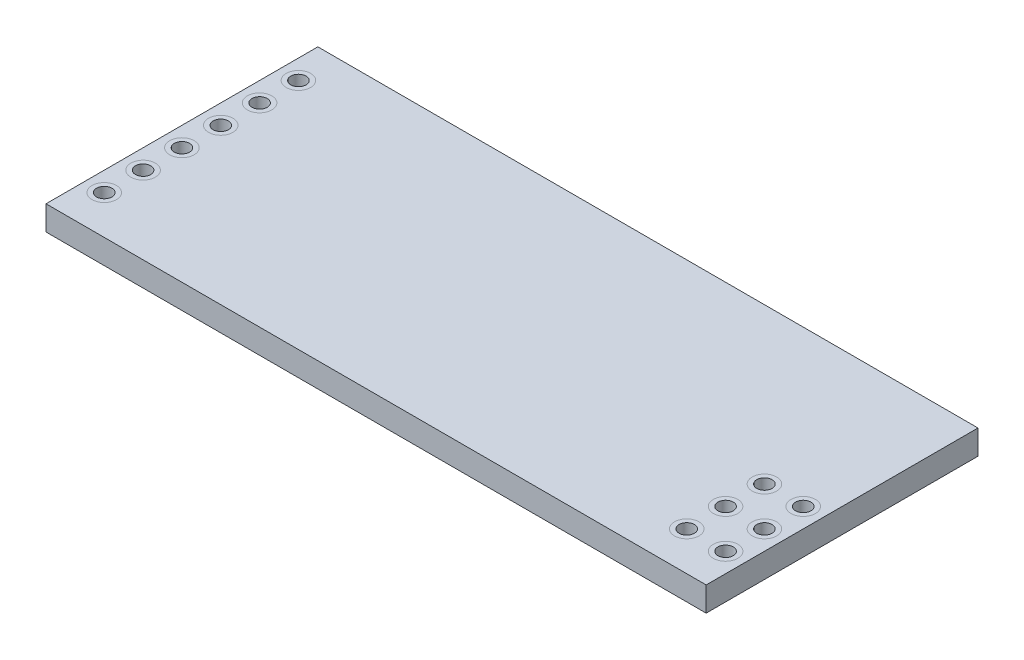
from build123d import *

# Parameters (mm, degrees)
SKETCH1_W           = 43.18
SKETCH1_H           = 17.78
SKETCH1_R           = 0.5
BOSS_EXTRUDE1_DEPTH = 1.6
CHAMFER1_SIZE       = 0.3
CHAMFER1_SIZE2      = 0.000523599
CHAMFER2_SIZE       = 0.3
CHAMFER2_SIZE2      = 0.000523599


with BuildPart() as part:
    # Sketch1 → Boss-Extrude1 (new body)
    with BuildSketch(Plane(origin=(0, 0, 0), x_dir=(1, 0, 0), z_dir=(0, 1, 0))):
        Rectangle(SKETCH1_W, SKETCH1_H)
        with Locations(Location((20.32, -6.35, 0), (0, 0, 270))):
            Circle(SKETCH1_R, mode=Mode.SUBTRACT)
        with Locations(Location((-20.32, 3.81, 0), (0, 0, 270))):
            Circle(SKETCH1_R, mode=Mode.SUBTRACT)
        with Locations(Location((-20.32, 1.27, 0), (0, 0, 270))):
            Circle(SKETCH1_R, mode=Mode.SUBTRACT)
        with Locations(Location((-20.32, -1.27, 0), (0, 0, 270))):
            Circle(SKETCH1_R, mode=Mode.SUBTRACT)
        with Locations(Location((-20.32, 6.35, 0), (0, 0, 270))):
            Circle(SKETCH1_R, mode=Mode.SUBTRACT)
        with Locations(Location((-20.32, -3.81, 0), (0, 0, 270))):
            Circle(SKETCH1_R, mode=Mode.SUBTRACT)
        with Locations(Location((-20.32, -6.35, 0), (0, 0, 270))):
            Circle(SKETCH1_R, mode=Mode.SUBTRACT)
        with Locations(Location((17.78, -6.35, 0), (0, 0, 270))):
            Circle(SKETCH1_R, mode=Mode.SUBTRACT)
        with Locations(Location((17.78, -3.81, 0), (0, 0, 270))):
            Circle(SKETCH1_R, mode=Mode.SUBTRACT)
        with Locations(Location((17.78, -1.27, 0), (0, 0, 270))):
            Circle(SKETCH1_R, mode=Mode.SUBTRACT)
        with Locations(Location((20.32, -3.81, 0), (0, 0, 270))):
            Circle(SKETCH1_R, mode=Mode.SUBTRACT)
        with Locations(Location((20.32, -1.27, 0), (0, 0, 270))):
            Circle(SKETCH1_R, mode=Mode.SUBTRACT)
    extrude(amount=BOSS_EXTRUDE1_DEPTH)

    # Chamfer1
    chamfer1_edges = [part.edges().sort_by_distance(p)[0] for p in [
        (20.32, 1.6, 5.85),
        (-20.32, 1.6, -4.31),
        (-20.32, 1.6, -1.77),
        (-20.32, 1.6, 0.77),
        (-20.32, 1.6, 3.31),
        (-20.32, 1.6, 5.85),
        (-20.32, 1.6, -6.85),
        (17.78, 1.6, 5.85),
        (17.78, 1.6, 3.31),
        (17.78, 1.6, 0.77),
        (20.32, 1.6, 3.31),
        (20.32, 1.6, 0.77),
    ]]
    chamfer1_side = [part.faces().sort_by_distance(p)[0] for p in [
        (0.007892141, 1.6, -0.023676424),
    ]]
    chamfer(chamfer1_edges, length=CHAMFER1_SIZE, length2=CHAMFER1_SIZE2, reference=chamfer1_side[0])

    # Chamfer2
    chamfer2_edges = [part.edges().sort_by_distance(p)[0] for p in [
        (20.32, 0, 5.85),
        (-20.32, 0, -4.31),
        (-20.32, 0, -1.77),
        (-20.32, 0, 0.77),
        (-20.32, 0, 3.31),
        (-20.32, 0, 5.85),
        (-20.32, 0, -6.85),
        (17.78, 0, 5.85),
        (17.78, 0, 3.31),
        (17.78, 0, 0.77),
        (20.32, 0, 3.31),
        (20.32, 0, 0.77),
    ]]
    chamfer2_side = [part.faces().sort_by_distance(p)[0] for p in [
        (0.007892141, 0, -0.023676424),
    ]]
    chamfer(chamfer2_edges, length=CHAMFER2_SIZE, length2=CHAMFER2_SIZE2, reference=chamfer2_side[0])


solid = part.part
